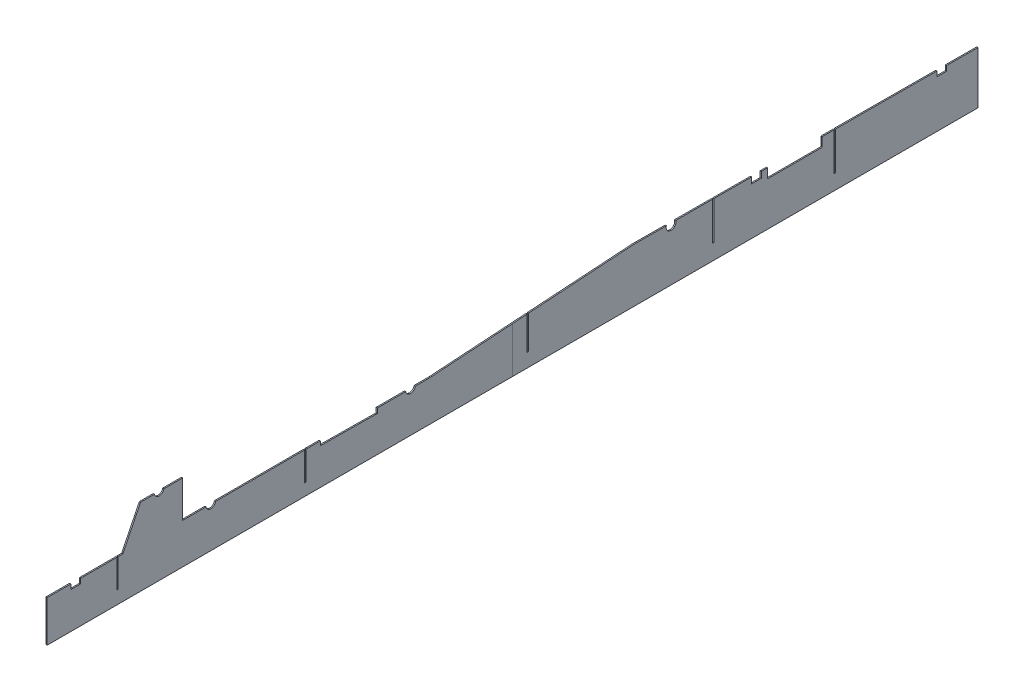
from build123d import *

# Parameters (mm, degrees)
BOSS_EXTRUDE1_DEPTH = 1.5875
CUT_EXTRUDE5_DEPTH  = 1733.843331241


with BuildPart() as part:
    # Sketch3 → Boss-Extrude1 (new, symmetric)
    with BuildSketch(Plane(origin=(0, 0, 0), x_dir=(0, 0, -1), z_dir=(1, 0, 0))):
        with BuildLine():
            Line((1727.2, -139.7), (1727.2, 0))
            Line((1727.2, 0), (1643.3038, 0.398291906))
            Line((1643.3038, 0.398291906), (1643.3038, -13.081))
            Line((1643.3038, -13.081), (1617.1418, -13.081))
            Line((1617.1418, -13.081), (1617.1418, 0.522494347))
            Line((1617.1418, 0.522494347), (1346.2, 1.808773415))
            Line((1346.2, 1.808773415), (1346.2, -99.791226585))
            Line((1346.2, -99.791226585), (1342.6186, -99.791226585))
            Line((1342.6186, -99.791226585), (1342.6186, 1.825775885))
            Line((1342.6186, 1.825775885), (1148.0038, 2.749697345))
            Line((1148.0038, 2.749697345), (1148.0038, -13.081))
            Line((1148.0038, -13.081), (1121.8418, -13.081))
            Line((1121.8418, -13.081), (1121.8418, 2.873899787))
            Line((1121.8418, 2.873899787), (1020.6228, 3.35443059))
            Line((1020.6228, 3.35443059), (1020.6228, -98.24556941))
            Line((1020.6228, -98.24556941), (1017.0414, -98.24556941))
            Line((1017.0414, -98.24556941), (1017.0414, 3.371433061))
            Line((1017.0414, 3.371433061), (918.828185443, 3.837694088))
            ThreePointArc((918.828185443, 3.837694088), (919.259095992, 1.94031106), (919.4038, 0))
            ThreePointArc((919.4038, 0), (904.32109725, -12.926938814), (893.85441584, 3.956255481))
            Line((893.85441584, 3.956255481), (807.550680013, 4.365977011))
            Line((807.550680013, 4.365977011), (525.3228, -14.277479423))
            Line((525.3228, -14.277479423), (525.3228, -103.177479423))
            Line((525.3228, -103.177479423), (521.7414, -103.177479423))
            Line((521.7414, -103.177479423), (521.7414, -14.514060143))
            Line((521.7414, -14.514060143), (260.820750269, -31.75))
            Line((260.820750269, -31.75), (222.61445683, -31.75))
            ThreePointArc((222.61445683, -31.75), (209.7532, -42.4434), (196.89194317, -31.75))
            Line((196.89194317, -31.75), (-69.6468, -31.75))
            Line((-69.6468, -31.75), (-69.6468, -107.95))
            Line((-69.6468, -107.95), (-73.2282, -107.95))
            Line((-73.2282, -107.95), (-73.2282, -31.75))
            Line((-73.2282, -31.75), (-311.45864317, -31.75))
            ThreePointArc((-311.45864317, -31.75), (-324.3199, -42.4434), (-337.18115683, -31.75))
            Line((-337.18115683, -31.75), (-399.579249731, -31.75))
            Line((-399.579249731, -31.75), (-399.579249731, 66.658263044))
            Line((-399.579249731, 66.658263044), (-449.685071474, 66.658263044))
            ThreePointArc((-449.685071474, 66.658263044), (-462.454755632, 56.414114736), (-475.224439789, 66.658263044))
            Line((-475.224439789, 66.658263044), (-512.373001058, 66.658263044))
            Line((-512.373001058, 66.658263044), (-559.824848458, -29.3624))
            Line((-559.824848458, -29.3624), (-571.9699, -29.3624))
            Line((-571.9699, -29.3624), (-571.9699, -105.5624))
            Line((-571.9699, -105.5624), (-575.5513, -105.5624))
            Line((-575.5513, -105.5624), (-575.5513, -29.3624))
            Line((-575.5513, -29.3624), (-672.719, -29.3624))
            Line((-672.719, -29.3624), (-672.719, -42.4434))
            Line((-672.719, -42.4434), (-698.881, -42.4434))
            Line((-698.881, -42.4434), (-698.881, -29.3624))
            Line((-698.881, -29.3624), (-762, -29.3624))
            Line((-762, -29.3624), (-762, -139.7))
            Line((-762, -139.7), (1727.2, -139.7))
        make_face()
    extrude(amount=BOSS_EXTRUDE1_DEPTH, both=True)

    # Sketch5 → Cut-Extrude5 (cut, through all)
    with BuildSketch(Plane(origin=(1.5875, 0, 0), x_dir=(0, 0, -1), z_dir=(1, 0, 0))):
        Polygon((1310.5638, -22.728682836), (1310.5638, 1.977954022), (1164.5138, 2.671317164), (1164.5138, -22.728682836), align=None)
        Polygon((120.8532, -44.45), (-31.5468, -42.857236965), (-31.5468, -31.75), (120.8532, -31.75), align=None)
    extrude(amount=-CUT_EXTRUDE5_DEPTH, mode=Mode.SUBTRACT)


solid = part.part
